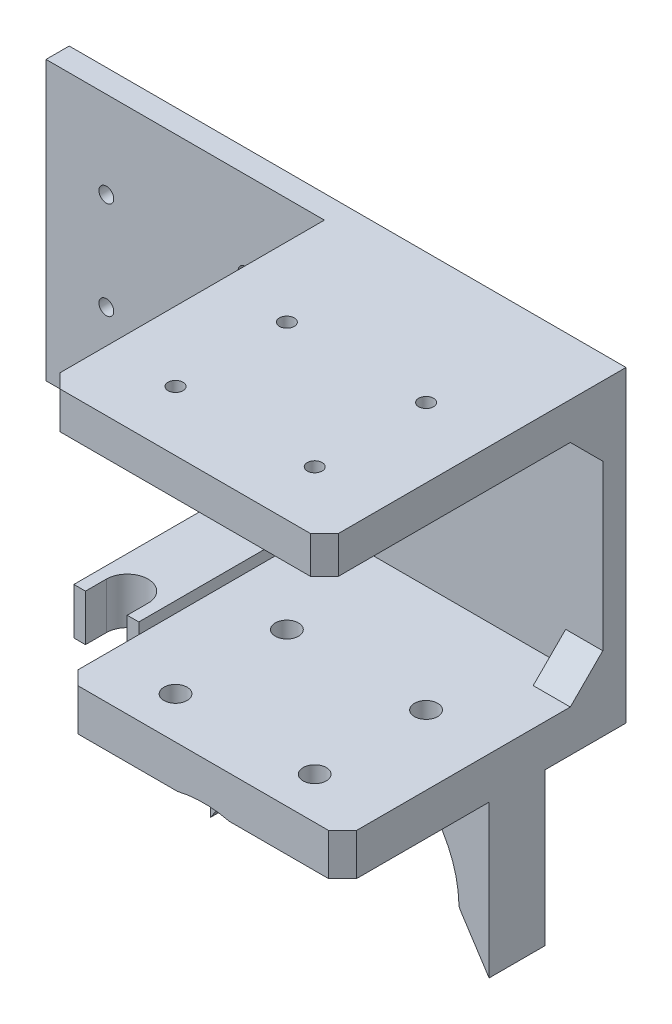
from build123d import *
from build123d.topology import SkipClean

# Parameters (mm, degrees)
SKETCH_1_W               = 120
SKETCH_1_H               = 60
EXTRUDE_1_DEPTH          = 5
SKETCH_3_W               = 60
SKETCH_3_H               = 8
EXTRUDE_3_DEPTH          = 60
SKETCH_4_W               = 61.088110118
SKETCH_4_H               = 9
EXTRUDE_4_DEPTH          = 60
SKETCH_6_R               = 23.5
CUT_EXTRUDE_1_DEPTH      = 134.603892159
EXTRUDE_5_DEPTH          = 50
SKETCH_8_W               = 20.5
SKETCH_8_H               = 32.830920687
SKETCH_8_W_2             = 17.5
CUT_EXTRUDE_2_DEPTH      = 60
EXTRUDE_6_DEPTH          = 10
SKETCH_11_R              = 1.6
CUT_EXTRUDE_3_DEPTH      = 141.605734288
SKETCH_12_R              = 1.6
CUT_EXTRUDE_4_DEPTH      = 134.603892159
RIB_1_REACH              = 160.193
SKETCH_13_WALL_W         = 328.285335328
SKETCH_13_WALL_H         = 8
MIRROR_2_COPY_1_REACH    = 160.193
MIRROR_2_COPY_1_SKETCH_W = 328.285335328
MIRROR_2_COPY_1_SKETCH_H = 8
SKETCH_15_W              = 5
SKETCH_15_H              = 6.382962656
EXTRUDE_7_DEPTH          = 10
CHAMFER_2_SIZE           = 2
CHAMFER_3_SIZE           = 3
SKETCH_16_R              = 2.5
CUT_EXTRUDE_5_DEPTH      = 122.419950598
SKETCH_18_R              = 3.75
CUT_EXTRUDE_7_DEPTH      = 2


with BuildPart() as part:
    # 草图1 → 凸台-拉伸1 (new body)
    with BuildSketch(Plane.XY):
        with Locations((-25, 50)):
            Rectangle(SKETCH_1_W, SKETCH_1_H)
    extrude(amount=EXTRUDE_1_DEPTH)

    # 草图3 → 凸台-拉伸3 (add)
    with BuildSketch(Plane.XY.offset(5)):
        with Locations((5, 76)):
            Rectangle(SKETCH_3_W, SKETCH_3_H)
    extrude(amount=EXTRUDE_3_DEPTH)

    # 草图4 → 凸台-拉伸4 (add)
    with BuildSketch(Plane(origin=(35, 0, 0), x_dir=(0, 0, -1), z_dir=(1, 0, 0))):
        with Locations((-30.544055059, 18.117037344)):
            Rectangle(SKETCH_4_W, SKETCH_4_H)
    extrude(amount=-EXTRUDE_4_DEPTH)

    # 草图6 → 切除-拉伸1 (cut, through all)
    with BuildSketch(Plane(origin=(0, 0, 0), x_dir=(-1, 0, 0), z_dir=(0, 0, -1))):
        with Locations((-5, -9.213883343)):
            Circle(SKETCH_6_R)
    extrude(amount=-CUT_EXTRUDE_1_DEPTH, mode=Mode.SUBTRACT)

    # 草图7 → 凸台-拉伸5 (add)
    with SkipClean():  # the faces are left unmerged after this step: merging them gives an invalid solid
        with BuildSketch(Plane(origin=(0, 0, 0), x_dir=(-1, 0, 0), z_dir=(0, 0, -1))):
            with BuildLine():
                Line((-10.567680001, 13.617037344), (-35, 13.617037344))
                Line((-35, 13.617037344), (-35, -9.213883343))
                Line((-35, -9.213883343), (-28.586195427, -9.213883343))
                ThreePointArc((-28.586195427, -9.213883343), (-28.52007955, -8.938912115), (-28.493409427, -8.657364267))
                ThreePointArc((-28.493409427, -8.657364267), (-23.307757139, 5.51961687), (-10.567680001, 13.617037344))
            make_face()
            with BuildLine():
                Line((25, 13.617037344), (0.567680001, 13.617037344))
                ThreePointArc((0.567680001, 13.617037344), (13.307757139, 5.51961687), (18.493409427, -8.657364267))
                ThreePointArc((18.493409427, -8.657364267), (18.52007955, -8.938912115), (18.586195427, -9.213883343))
                Line((18.586195427, -9.213883343), (25, -9.213883343))
                Line((25, -9.213883343), (25, 13.617037344))
            make_face()
            with BuildLine():
                Line((25, -9.213883343), (18.586195427, -9.213883343))
                ThreePointArc((18.586195427, -9.213883343), (18.684669265, -9.464686705), (18.815961295, -9.699977643))
                Line((18.815961295, -9.699977643), (25, -19.213883343))
                Line((25, -19.213883343), (25, -9.213883343))
            make_face()
            with BuildLine():
                Line((-28.586195427, -9.213883343), (-35, -9.213883343))
                Line((-35, -9.213883343), (-35, -19.213883343))
                Line((-35, -19.213883343), (-28.815961295, -9.699977643))
                ThreePointArc((-28.815961295, -9.699977643), (-28.684669265, -9.464686705), (-28.586195427, -9.213883343))
            make_face()
        extrude(amount=-EXTRUDE_5_DEPTH)

    # 草图8 → 切除-拉伸2 (cut)
    with SkipClean():  # the faces are left unmerged after this step: merging them gives an invalid solid
        with BuildSketch(Plane(origin=(35, 0, 0), x_dir=(0, 0, -1), z_dir=(1, 0, 0))):
            with Locations((-39.75, -2.798423)):
                Rectangle(SKETCH_8_W, SKETCH_8_H)
            with Locations((-8.75, -2.798423)):
                Rectangle(SKETCH_8_W_2, SKETCH_8_H)
        extrude(amount=-CUT_EXTRUDE_2_DEPTH, mode=Mode.SUBTRACT)

    # 草图9 → 凸台-拉伸6 (add)
    with SkipClean():  # the faces are left unmerged after this step: merging them gives an invalid solid
        with BuildSketch(Plane.XZ.offset(-20)):
            with BuildLine():
                Line((-32.5, 0), (-41.5, 0))
                Line((-41.5, 0), (-44, 0))
                Line((-44, 0), (-44, 40))
                Line((-44, 40), (-41.5, 40))
                Line((-41.5, 40), (-41.5, 35.5))
                ThreePointArc((-41.5, 35.5), (-37, 31), (-32.5, 35.5))
                Line((-32.5, 35.5), (-32.5, 40))
                Line((-32.5, 40), (-30, 40))
                Line((-30, 40), (-30, 0))
                Line((-30, 0), (-32.5, 0))
            make_face()
        extrude(amount=EXTRUDE_6_DEPTH)

    # 草图11 → 切除-拉伸3 (cut, through all)
    with SkipClean():  # the faces are left unmerged after this step: merging them gives an invalid solid
        with BuildSketch(Plane(origin=(0, 72, 0), x_dir=(-1, 0, 0), z_dir=(0, -1, 0))):
            with Locations(Location((-20, -52.088110118, 0), (0, 0, 90))):
                Circle(SKETCH_11_R)
            with Locations(Location((10, -28.088110118, 0), (0, 0, 90))):
                Circle(SKETCH_11_R)
            with Locations(Location((-20, -28.088110118, 0), (0, 0, 90))):
                Circle(SKETCH_11_R)
            with Locations(Location((10, -52.088110118, 0), (0, 0, 90))):
                Circle(SKETCH_11_R)
        extrude(amount=-CUT_EXTRUDE_3_DEPTH, mode=Mode.SUBTRACT)

    # 草图12 → 切除-拉伸4 (cut, through all)
    with SkipClean():  # the faces are left unmerged after this step: merging them gives an invalid solid
        with BuildSketch(Plane(origin=(0, 0, 0), x_dir=(-1, 0, 0), z_dir=(0, 0, -1))):
            with Locations((42, 40.25)):
                Circle(SKETCH_12_R)
            with Locations((42, 61.25)):
                Circle(SKETCH_12_R)
            with Locations((72, 40.25)):
                Circle(SKETCH_12_R)
            with Locations((72, 61.25)):
                Circle(SKETCH_12_R)
        extrude(amount=-CUT_EXTRUDE_4_DEPTH, mode=Mode.SUBTRACT)

    # 草图13 wall → 筋1 (add, up to next)
    with BuildSketch(Plane(origin=(35, 68.5, 8.5), x_dir=(0, 0.707106781187, 0.707106781187), z_dir=(0, -0.707106781187, 0.707106781187)), mode=Mode.PRIVATE) as rib_1_sk1:
        with Locations((0, 4)):
            Rectangle(SKETCH_13_WALL_W, SKETCH_13_WALL_H)
    rib_1_tool1 = extrude(rib_1_sk1.sketch, amount=-RIB_1_REACH, mode=Mode.PRIVATE) - part.part
    rib_1 = rib_1_tool1.solids().sort_by_distance((35, 68.5, 8.5))[0]
    add(rib_1)

    # 镜向1: 筋1 across plane
    with SkipClean():  # the faces are left unmerged after this step: merging them gives an invalid solid
        add(rib_1.mirror(Plane(origin=(5, 0, 0), x_dir=(0, 0, 1), z_dir=(1, 0, 0))))

    # 镜向2: 筋1 across plane
    with SkipClean():  # the faces are left unmerged after this step: merging them gives an invalid solid
        add(rib_1.mirror(Plane(origin=(0, 47.308518672, 0), x_dir=(0, 0, 1), z_dir=(0, -1, 0))))

    # 镜向2 copy 1 sketch → 镜向2 copy 1 (add, up to next)
    with BuildSketch(Plane(origin=(-25, 26.117037344, 8.5), x_dir=(0, -0.7071067811870001, 0.7071067811869999), z_dir=(0, 0.7071067811869999, 0.7071067811870001)), mode=Mode.PRIVATE) as mirror_2_copy_1_sk1:
        with Locations((0, 4)):
            Rectangle(MIRROR_2_COPY_1_SKETCH_W, MIRROR_2_COPY_1_SKETCH_H)
    mirror_2_copy_1_tool1 = extrude(mirror_2_copy_1_sk1.sketch, amount=-MIRROR_2_COPY_1_REACH, mode=Mode.PRIVATE) - part.part
    add(mirror_2_copy_1_tool1.solids().sort_by_distance((-25, 26.117037344, 8.5))[0])

    # 草图15 → 凸台-拉伸7 (add)
    with SkipClean():  # the faces are left unmerged after this step: merging them gives an invalid solid
        with BuildSketch(Plane(origin=(0, 0, 0), x_dir=(-1, 0, 0), z_dir=(0, 0, -1))):
            with Locations((27.5, 16.808518672)):
                Rectangle(SKETCH_15_W, SKETCH_15_H)
            with Locations((46.5, 16.808518672)):
                Rectangle(SKETCH_15_W, SKETCH_15_H)
        extrude(amount=-EXTRUDE_7_DEPTH)

    # 倒角2
    chamfer_2_edges = [part.edges().sort_by_distance(p)[0] for p in [
        (-49, 16.808518672, 10),
    ]]
    chamfer(chamfer_2_edges, length=CHAMFER_2_SIZE)

    # 倒角3
    chamfer_3_edges = [part.edges().sort_by_distance(p)[0] for p in [
        (-25, 76, 65),
        (35, 76, 65),
        (35, 18.117037344, 61.088110118),
        (-25, 18.117037344, 61.088110118),
    ]]
    chamfer(chamfer_3_edges, length=CHAMFER_3_SIZE)

    # 草图16 → 切除-拉伸5 (cut, through all)
    with SkipClean():  # the faces are left unmerged after this step: merging them gives an invalid solid
        with BuildSketch(Plane(origin=(0, 22.617037344, 0), x_dir=(1, 0, 0), z_dir=(0, 1, 0))):
            with Locations(Location((20, -52.088110118, 0), (0, 0, 180))):
                Circle(SKETCH_16_R)
            with Locations(Location((-10, -52.088110118, 0), (0, 0, 180))):
                Circle(SKETCH_16_R)
            with Locations(Location((-10, -28.088110118, 0), (0, 0, 180))):
                Circle(SKETCH_16_R)
            with Locations(Location((20, -28.088110118, 0), (0, 0, 180))):
                Circle(SKETCH_16_R)
        extrude(amount=-CUT_EXTRUDE_5_DEPTH, mode=Mode.SUBTRACT)

    # 草图18 → 切除-拉伸7 (cut)
    with SkipClean():  # the faces are left unmerged after this step: merging them gives an invalid solid
        with BuildSketch(Plane(origin=(0, 0, 0), x_dir=(-1, 0, 0), z_dir=(0, 0, -1))):
            with Locations((75, 75)):
                Circle(SKETCH_18_R)
            with Locations((25, 75)):
                Circle(SKETCH_18_R)
            with Locations((-25, 75)):
                Circle(SKETCH_18_R)
            with Locations((-25, 25)):
                Circle(SKETCH_18_R)
            with Locations((25, 25)):
                Circle(SKETCH_18_R)
            with Locations((75, 25)):
                Circle(SKETCH_18_R)
        extrude(amount=-CUT_EXTRUDE_7_DEPTH, mode=Mode.SUBTRACT)


solid = part.part
